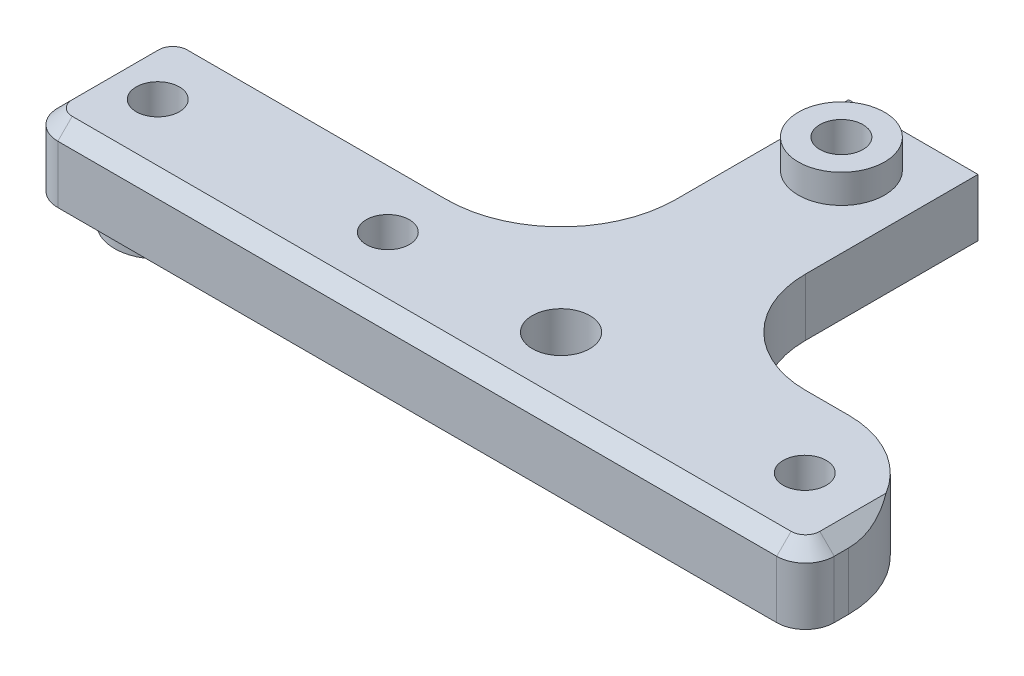
from build123d import *

# Parameters (mm, degrees)
SKETCH1_W           = 54
SKETCH1_H           = 10
BOSS_EXTRUDE1_DEPTH = 5
SKETCH3_R           = 1.5
SKETCH3_R_2         = 2
CUT_EXTRUDE1_DEPTH  = 7
FILLET1_R           = 2
SKETCH4_R           = 3
SKETCH4_R_2         = 1.5
BOSS_EXTRUDE2_DEPTH = 2.5
SKETCH5_W           = 10
SKETCH5_H           = 5
BOSS_EXTRUDE3_DEPTH = 19
SKETCH6_R           = 1.5
CUT_EXTRUDE2_DEPTH  = 10
BOSS_EXTRUDE4_START = 2
SKETCH7_R           = 3
SKETCH7_R_2         = 1.5
BOSS_EXTRUDE4_DEPTH = 2
FILLET2_R           = 7
CHAMFER1_SIZE       = 1
FILLET3_R           = 7


with BuildPart() as part:
    # Sketch1 → Boss-Extrude1 (new body)
    with BuildSketch(Plane(origin=(0, 0, 0), x_dir=(1, 0, 0), z_dir=(0, 1, 0))):
        Rectangle(SKETCH1_W, SKETCH1_H)
    extrude(amount=BOSS_EXTRUDE1_DEPTH)

    # Sketch3 → Cut-Extrude1 (cut)
    with BuildSketch(Plane(origin=(0, 5, 0), x_dir=(1, 0, 0), z_dir=(0, 1, 0))):
        with Locations(Location((-23.05, 0, 0), (0, 0, 270))):
            Circle(SKETCH3_R)
        with Locations(Location((5, 0, 0), (0, 0, 270))):
            Circle(SKETCH3_R_2)
        with Locations(Location((-7.05, 0, 0), (0, 0, 270))):
            Circle(SKETCH3_R)
        with Locations(Location((21.95, 0, 0), (0, 0, 270))):
            Circle(SKETCH3_R)
    extrude(amount=-CUT_EXTRUDE1_DEPTH, mode=Mode.SUBTRACT)

    # Fillet1
    fillet1_edges = [part.edges().sort_by_distance(p)[0] for p in [
        (27, 2.5, 5),
        (-27, 2.5, 5),
        (-27, 2.5, -5),
    ]]
    fillet(fillet1_edges, radius=FILLET1_R)

    # Sketch4 → Boss-Extrude2 (add)
    with BuildSketch(Plane.XZ):
        with Locations(Location((-23.05, 0, 0), (0, 0, 270))):
            Circle(SKETCH4_R)
        with Locations(Location((-23.05, 0, 0), (0, 0, 90))):
            Circle(SKETCH4_R_2, mode=Mode.SUBTRACT)
    extrude(amount=BOSS_EXTRUDE2_DEPTH)

    # Sketch5 → Boss-Extrude3 (add)
    with BuildSketch(Plane(origin=(0, 0, -5), x_dir=(-1, 0, 0), z_dir=(0, 0, -1))):
        with Locations((-5, 2.5)):
            Rectangle(SKETCH5_W, SKETCH5_H)
    extrude(amount=BOSS_EXTRUDE3_DEPTH)

    # Sketch6 → Cut-Extrude2 (cut)
    with BuildSketch(Plane(origin=(0, 5, 0), x_dir=(1, 0, 0), z_dir=(0, 1, 0))):
        with Locations(Location((5, 19.5, 0), (0, 0, 270))):
            Circle(SKETCH6_R)
    extrude(amount=-CUT_EXTRUDE2_DEPTH, mode=Mode.SUBTRACT)

    # Sketch7 → Boss-Extrude4 (add)
    with BuildSketch(Plane(origin=(0, 5, 0), x_dir=(1, 0, 0), z_dir=(0, 1, 0)).offset(BOSS_EXTRUDE4_START)):
        with Locations(Location((5, 19.5, 0), (0, 0, 270))):
            Circle(SKETCH7_R)
        with Locations(Location((5, 19.5, 0), (0, 0, 270))):
            Circle(SKETCH7_R_2, mode=Mode.SUBTRACT)
    extrude(amount=-BOSS_EXTRUDE4_DEPTH)

    # Fillet2
    fillet2_edges = [part.edges().sort_by_distance(p)[0] for p in [
        (10, 2.5, -5),
        (0, 2.5, -5),
    ]]
    fillet(fillet2_edges, radius=FILLET2_R)

    # Chamfer1
    chamfer1_edges = [part.edges().sort_by_distance(p)[0] for p in [
        (10, 0, -18),
        (12.050252532, 0, -7.050252532),
        (22, 0, -5),
        (0, 5, -18),
        (-2.050252532, 5, -7.050252532),
        (-16, 5, -5),
        (-26.414213562, 5, -4.414213562),
        (-27, 5, 0),
        (-26.414213562, 5, 4.414213562),
        (0, 5, 5),
        (26.414213562, 5, 4.414213562),
        (27, 5, -1),
    ]]
    chamfer(chamfer1_edges, length=CHAMFER1_SIZE)

    # Fillet3
    fillet3_edges = [part.edges().sort_by_distance(p)[0] for p in [
        (27, 2.5, -5),
    ]]
    fillet(fillet3_edges, radius=FILLET3_R)


solid = part.part
